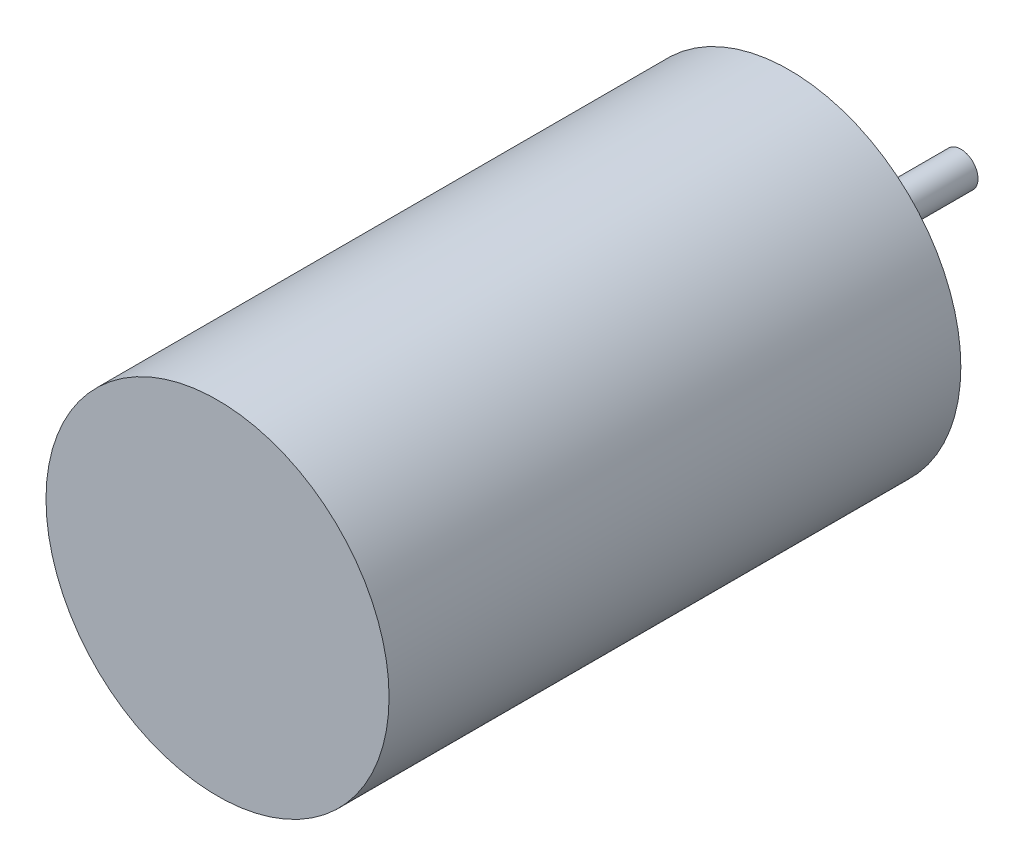
from build123d import *

# Parameters (mm, degrees)
SKETCH1_R           = 15
BOSS_EXTRUDE1_DEPTH = 50
SKETCH2_R           = 1.5
BOSS_EXTRUDE2_DEPTH = 15


with BuildPart() as part:
    # Sketch1 → Boss-Extrude1 (new body)
    with BuildSketch(Plane.XY):
        Circle(SKETCH1_R)
    extrude(amount=BOSS_EXTRUDE1_DEPTH)

    # Sketch2 → Boss-Extrude2 (add)
    with BuildSketch(Plane(origin=(0, 0, 0), x_dir=(-1, 0, 0), z_dir=(0, 0, -1))):
        with Locations(Location((0, 0, 0), (0, 0, 180))):
            Circle(SKETCH2_R)
    extrude(amount=BOSS_EXTRUDE2_DEPTH)


solid = part.part
